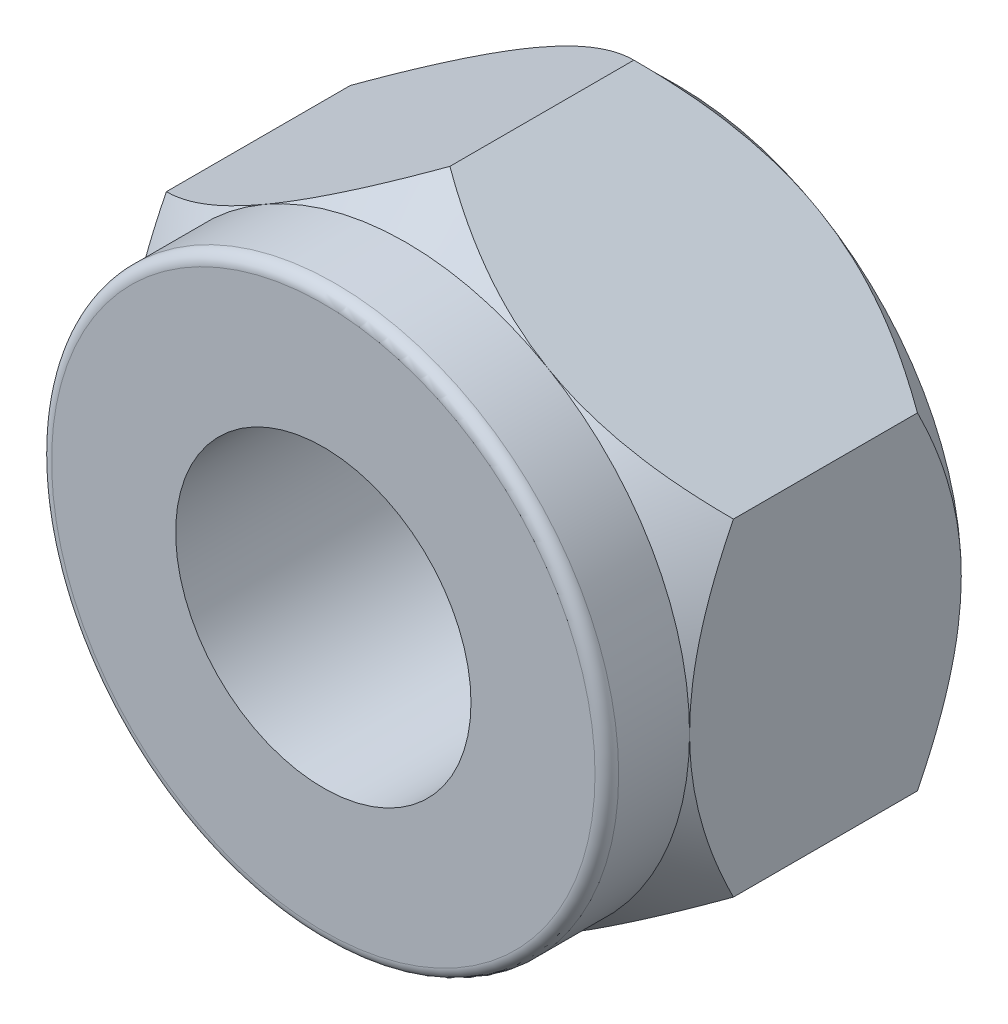
from build123d import *

# Parameters (mm, degrees)
EXTRUDE_1_DEPTH      = 2.3
SKETCH_2_R           = 2.4
EXTRUDE_2_DEPTH      = 0.7
SKETCH_3_R           = 1.25
CUT_EXTRUDE_1_DEPTH  = 5.737087713
SKETCH_4_OUTSIDE_W   = 10.384
SKETCH_4_OUTSIDE_H   = 11.126
SKETCH_4_OUTSIDE_R   = 2.400007284
CUT_EXTRUDE_10_DEPTH = 1
CUT_EXTRUDE_10_DRAFT = -45
SKETCH_2_4_OUTSIDE_W = 10.384
SKETCH_2_4_OUTSIDE_H = 11.126
SKETCH_2_4_OUTSIDE_R = 2.4
CUT_EXTRUDE_11_DEPTH = 1
CUT_EXTRUDE_11_DRAFT = -45
FILLET_1_R           = 0.1


with BuildPart() as part:
    # 草图1 → 凸台-拉伸1 (new body)
    with BuildSketch(Plane.XY):
        Polygon((0, 2.771281292), (-2.4, 1.385640646), (-2.4, -1.385640646), (0, -2.771281292), (2.4, -1.385640646), (2.4, 1.385640646), align=None)
    extrude(amount=EXTRUDE_1_DEPTH)

    # 草图2 → 凸台-拉伸2 (add)
    with BuildSketch(Plane.XY.offset(2.3)):
        Circle(SKETCH_2_R)
    extrude(amount=EXTRUDE_2_DEPTH)

    # 草图3 → 切除-拉伸1 (cut, through all)
    with BuildSketch(Plane.XY.offset(3)):
        Circle(SKETCH_3_R)
    extrude(amount=-CUT_EXTRUDE_1_DEPTH, mode=Mode.SUBTRACT)


with BuildPart() as cut_extrude_10_tool:
    # 草图4 outside → 切除-拉伸10 (with draft: the straight prism first)
    with BuildSketch(Plane(origin=(0, 0, 0), x_dir=(-1, 0, 0), z_dir=(0, 0, -1))):
        Rectangle(SKETCH_4_OUTSIDE_W, SKETCH_4_OUTSIDE_H)
        Circle(SKETCH_4_OUTSIDE_R, mode=Mode.SUBTRACT)
    extrude(amount=-CUT_EXTRUDE_10_DEPTH)
    # 切除-拉伸10: the draft: its side faces are tilted about the plane it starts from
    cut_extrude_10_sides = [cut_extrude_10_tool.faces().sort_by_distance(p)[0] for p in [
        (0, -5.563, 0.5),
        (-5.192, 0, 0.5),
        (0, 5.563, 0.5),
        (5.192, 0, 0.5),
        (2.400007284, 0, 0.5),
    ]]
    draft(cut_extrude_10_sides, Plane(origin=(0, 0, 0), x_dir=(-1, 0, 0), z_dir=(0, 0, -1)), CUT_EXTRUDE_10_DRAFT)


with BuildPart() as part_1:
    add(part.part)

    # 切除-拉伸10: cut by cut_extrude_10_tool
    add(cut_extrude_10_tool.part, mode=Mode.SUBTRACT)


with BuildPart() as cut_extrude_11_tool:
    # 草图2<4> outside → 切除-拉伸11 (with draft: the straight prism first)
    with BuildSketch(Plane.XY.offset(2.3)):
        Rectangle(SKETCH_2_4_OUTSIDE_W, SKETCH_2_4_OUTSIDE_H)
        Circle(SKETCH_2_4_OUTSIDE_R, mode=Mode.SUBTRACT)
    extrude(amount=-CUT_EXTRUDE_11_DEPTH)
    # 切除-拉伸11: the draft: its side faces are tilted about the plane it starts from
    cut_extrude_11_sides = [cut_extrude_11_tool.faces().sort_by_distance(p)[0] for p in [
        (0, -5.563, 1.8),
        (5.192, 0, 1.8),
        (0, 5.563, 1.8),
        (-5.192, 0, 1.8),
        (-2.4, 0, 1.8),
    ]]
    draft(cut_extrude_11_sides, Plane.XY.offset(2.3), CUT_EXTRUDE_11_DRAFT)


with BuildPart() as part_2:
    add(part_1.part)

    # 切除-拉伸11: cut by cut_extrude_11_tool
    add(cut_extrude_11_tool.part, mode=Mode.SUBTRACT)

    # 圆角1
    fillet_1_edges = [part_2.edges().sort_by_distance(p)[0] for p in [
        (-2.4, 0, 3),
    ]]
    fillet(fillet_1_edges, radius=FILLET_1_R)


solid = part_2.part
